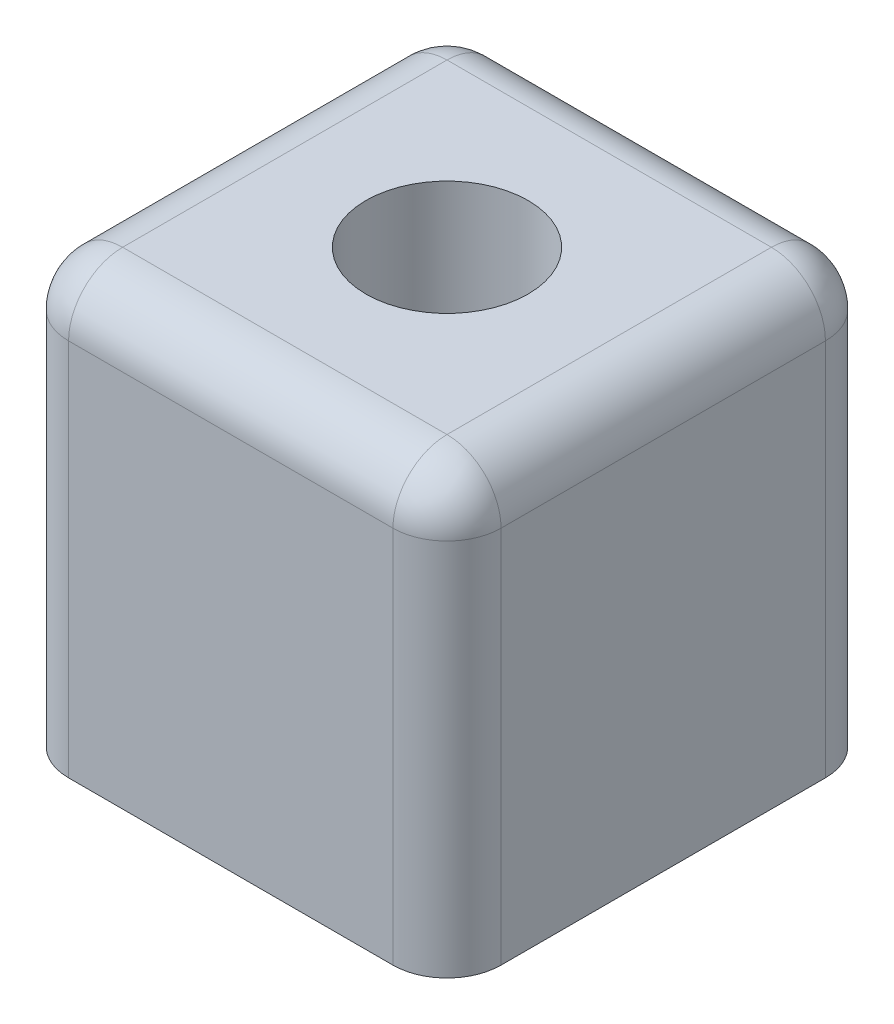
from build123d import *

# Parameters (mm, degrees)
IZIM1_W                     = 80
IZIM1_H                     = 80
Y_KSEKLIK_EKSTR_ZYON1_DEPTH = 80
IZIM2_R                     = 15
KES_EKSTR_ZYON1_DEPTH       = 50
RADYUS1_R                   = 10
BO_ALTMA1_T                 = -3


with BuildPart() as part:
    # Çizim1 → Yükseklik-Ekstrüzyon1 (new body)
    with BuildSketch(Plane.XY):
        with Locations((40, 40)):
            Rectangle(IZIM1_W, IZIM1_H)
    extrude(amount=Y_KSEKLIK_EKSTR_ZYON1_DEPTH)

    # Çizim2 → Kes-Ekstrüzyon1 (cut)
    with BuildSketch(Plane(origin=(0, 80, 0), x_dir=(1, 0, 0), z_dir=(0, 1, 0))):
        with Locations(Location((40, -40, 0), (0, 0, 270))):
            Circle(IZIM2_R)
    extrude(amount=-KES_EKSTR_ZYON1_DEPTH, mode=Mode.SUBTRACT)

    # Radyus1
    radyus1_edges = [part.edges().sort_by_distance(p)[0] for p in [
        (80, 40, 80),
        (40, 80, 80),
        (0, 40, 80),
        (40, 80, 0),
        (80, 40, 0),
        (0, 40, 0),
        (0, 80, 40),
        (80, 80, 40),
    ]]
    fillet(radyus1_edges, radius=RADYUS1_R)

    # İç Boşaltma1
    bo_altma1_openings = [part.faces().sort_by_distance(p)[0] for p in [
        (40, 0, 40),
    ]]
    offset(amount=BO_ALTMA1_T, openings=bo_altma1_openings, kind=Kind.INTERSECTION)


solid = part.part
